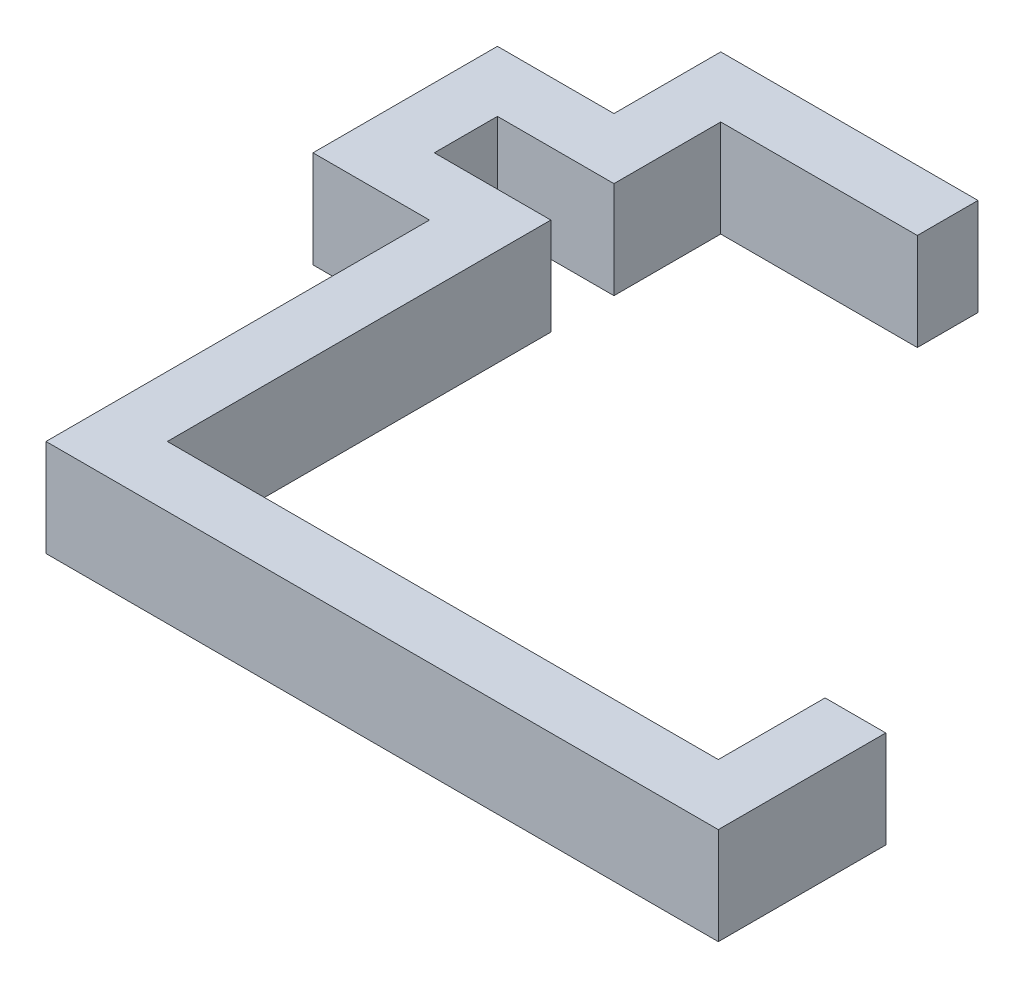
from build123d import *

# Parameters (mm, degrees)
BOSS_EXTRUDE1_DEPTH = 4


with BuildPart() as part:
    # Sketch1 → Boss-Extrude1 (new body)
    with BuildSketch(Plane(origin=(0, 0, 0), x_dir=(1, 0, 0), z_dir=(0, 1, 0))):
        Polygon((0, 0), (-22.7, 0), (-22.7, 15.8), (-27.5, 15.8), (-27.5, 18.4), (-22.7, 18.4), (-22.7, 22.8), (-14.6, 22.8), (-14.6, 25.3), (-25.2, 25.3), (-25.2, 20.9), (-30, 20.9), (-30, 13.3), (-25.2, 13.3), (-25.2, -2.5), (2.5, -2.5), (2.5, 4.4), (0, 4.4), align=None)
    extrude(amount=BOSS_EXTRUDE1_DEPTH)


solid = part.part
